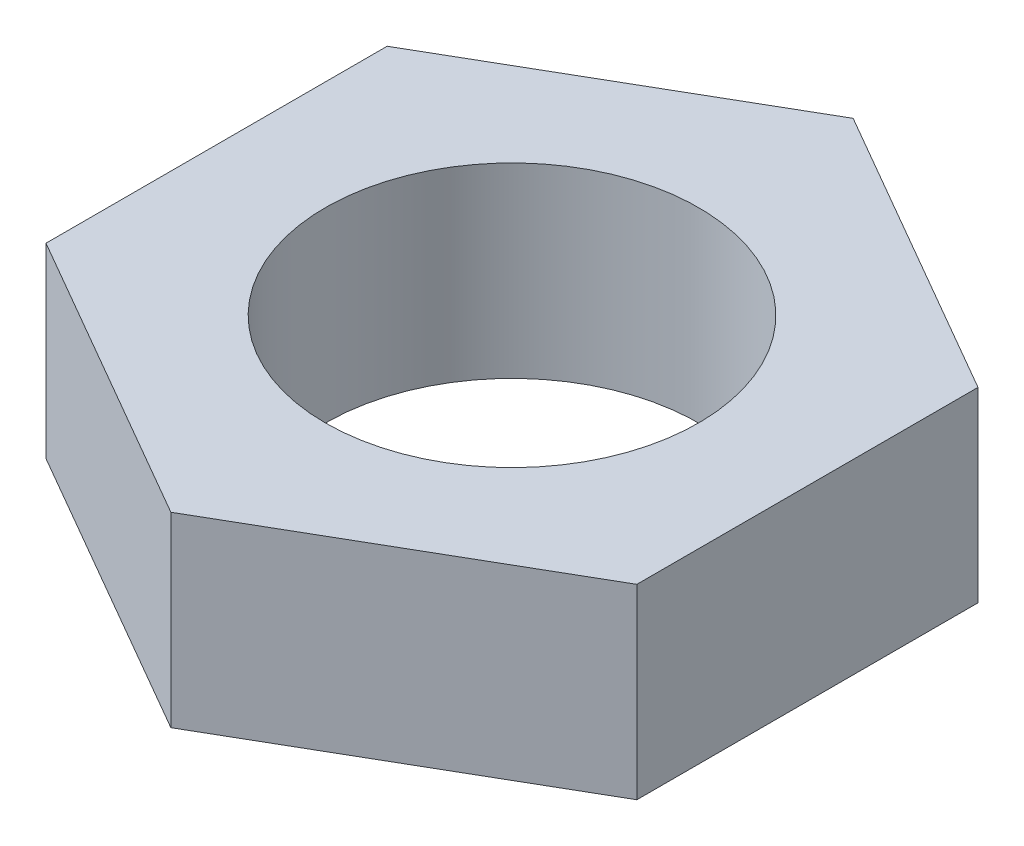
from build123d import *

# Parameters (mm, degrees)
SKETCH1_R           = 6
BOSS_EXTRUDE1_DEPTH = 6


with BuildPart() as part:
    # Sketch1 → Boss-Extrude1 (new body)
    with BuildSketch(Plane(origin=(0, 0, 0), x_dir=(1, 0, 0), z_dir=(0, 1, 0))):
        Polygon((0, 10.969655115), (-9.5, 5.484827557), (-9.5, -5.484827557), (0, -10.969655115), (9.5, -5.484827557), (9.5, 5.484827557), align=None)
        with Locations(Location((0, 0, 0), (0, 0, 270))):
            Circle(SKETCH1_R, mode=Mode.SUBTRACT)
    extrude(amount=BOSS_EXTRUDE1_DEPTH)


solid = part.part
